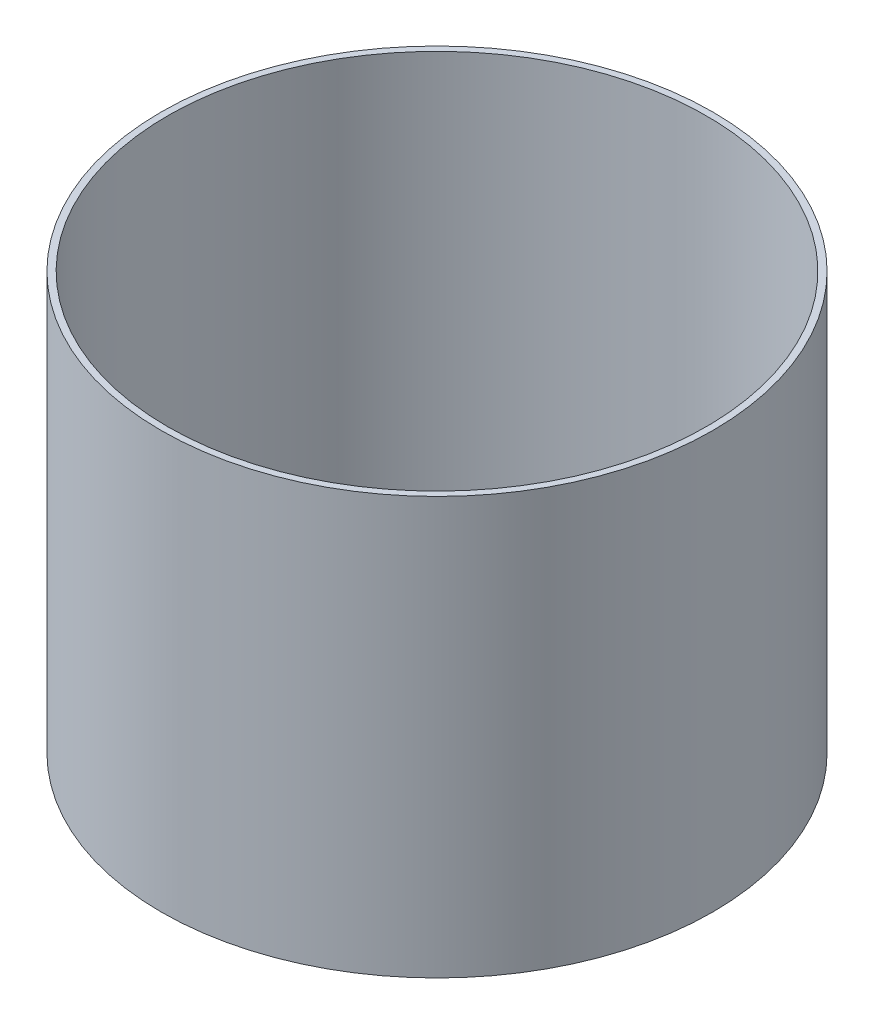
from build123d import *

# Parameters (mm, degrees)
SKETCH1_R           = 7.9375
SKETCH1_R_2         = 7.75
BOSS_EXTRUDE1_DEPTH = 12


with BuildPart() as part:
    # Sketch1 → Boss-Extrude1 (new body)
    with BuildSketch(Plane(origin=(0, 0, 0), x_dir=(1, 0, 0), z_dir=(0, 1, 0))):
        with Locations(Location((0, 0, 0), (0, 0, 270))):
            Circle(SKETCH1_R)
        with Locations(Location((0, 0, 0), (0, 0, 270))):
            Circle(SKETCH1_R_2, mode=Mode.SUBTRACT)
    extrude(amount=BOSS_EXTRUDE1_DEPTH)


solid = part.part
